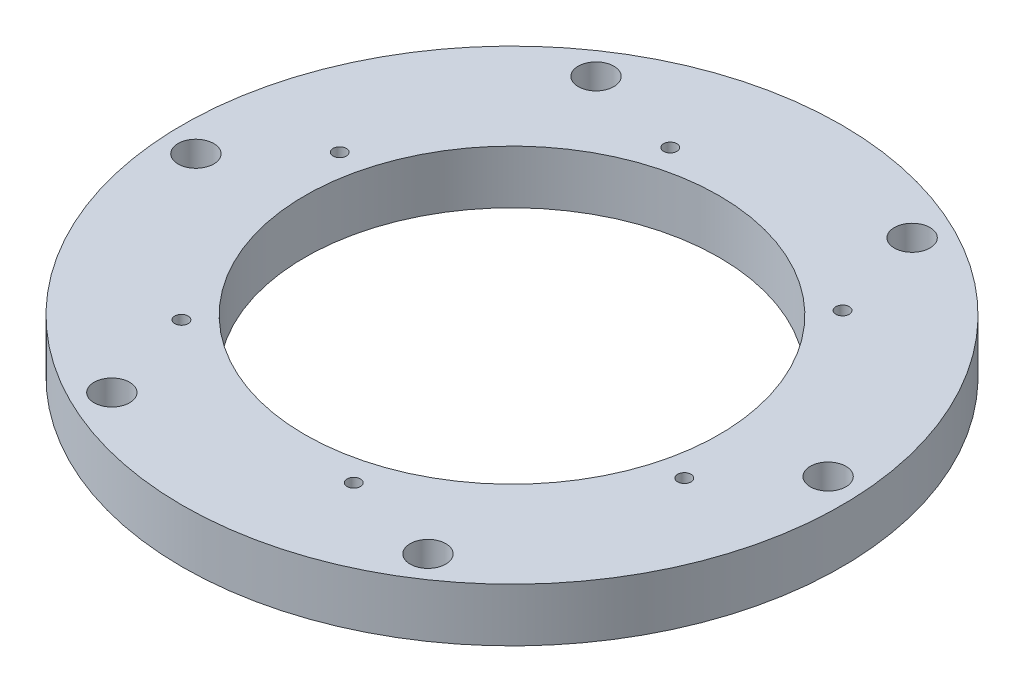
from build123d import *

# Parameters (mm, degrees)
SKETCH_1_R      = 74
SKETCH_1_R_2    = 46.5
SKETCH_1_R_3    = 1.5
SKETCH_1_R_4    = 4
EXTRUDE_2_DEPTH = 12


with BuildPart() as part:
    # 草图1 → 凸台-拉伸2 (new body)
    with BuildSketch(Plane(origin=(0, 0, 0), x_dir=(1, 0, 0), z_dir=(0, 1, 0))):
        with Locations(Location((0, 0, 0), (0, 0, 270))):
            Circle(SKETCH_1_R)
        with Locations(Location((0, 0, 0), (0, 0, 270))):
            Circle(SKETCH_1_R_2, mode=Mode.SUBTRACT)
        with Locations(Location((36.199702934, 38.024091146, 0), (0, 0, 270))):
            Circle(SKETCH_1_R_3, mode=Mode.SUBTRACT)
        with Locations(Location((29.881416045, 59.967499324, 0), (0, 0, 270))):
            Circle(SKETCH_1_R_4, mode=Mode.SUBTRACT)
        with Locations(Location((66.874085838, 4.105684266, 0), (0, 0, 270))):
            Circle(SKETCH_1_R_4, mode=Mode.SUBTRACT)
        with Locations(Location((51.029680355, -12.337816778, 0), (0, 0, 270))):
            Circle(SKETCH_1_R_3, mode=Mode.SUBTRACT)
        with Locations(Location((36.992669793, -55.861815058, 0), (0, 0, 270))):
            Circle(SKETCH_1_R_4, mode=Mode.SUBTRACT)
        with Locations(Location((14.829977421, -50.361907923, 0), (0, 0, 270))):
            Circle(SKETCH_1_R_3, mode=Mode.SUBTRACT)
        with Locations(Location((-29.881416045, -59.967499324, 0), (0, 0, 270))):
            Circle(SKETCH_1_R_4, mode=Mode.SUBTRACT)
        with Locations(Location((-36.199702934, -38.024091146, 0), (0, 0, 270))):
            Circle(SKETCH_1_R_3, mode=Mode.SUBTRACT)
        with Locations(Location((-66.874085838, -4.105684266, 0), (0, 0, 270))):
            Circle(SKETCH_1_R_4, mode=Mode.SUBTRACT)
        with Locations(Location((-51.029680355, 12.337816778, 0), (0, 0, 270))):
            Circle(SKETCH_1_R_3, mode=Mode.SUBTRACT)
        with Locations(Location((-36.992669793, 55.861815058, 0), (0, 0, 270))):
            Circle(SKETCH_1_R_4, mode=Mode.SUBTRACT)
        with Locations(Location((-14.829977421, 50.361907923, 0), (0, 0, 270))):
            Circle(SKETCH_1_R_3, mode=Mode.SUBTRACT)
    extrude(amount=EXTRUDE_2_DEPTH)


solid = part.part
